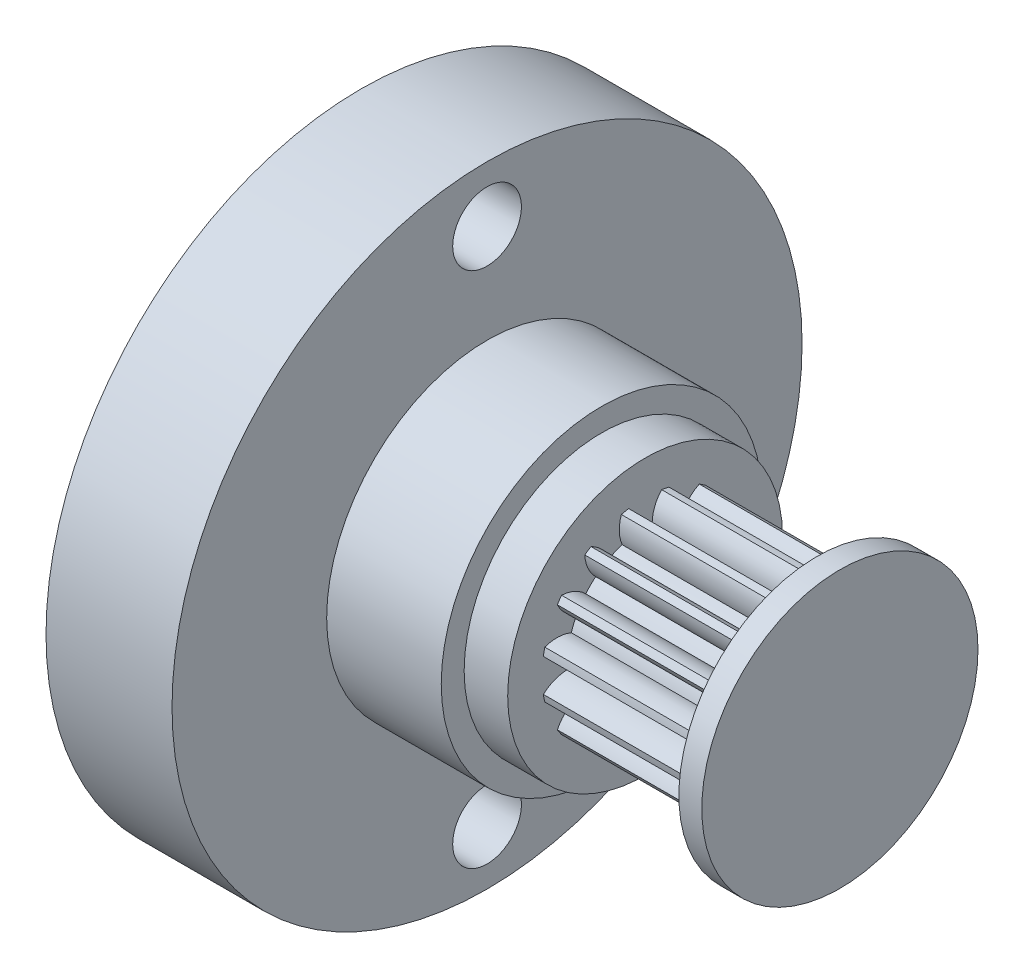
from build123d import *

# Parameters (mm, degrees)
BASPROSKE_W             = 7.5
BASPROSKE_H             = 4.5
TOOTHCUT_DEPTH          = 10.836157786
TEETHCUTS_COUNT         = 16
TEETHCUTS_ANGLE         = 337.5
BORSKE_R                = 2.5
BORE_DEPTH              = 50.0000508
ESQUISSE4_R             = 6
BOSS_EXTRU_3_DEPTH      = 1.9
ESQUISSE5_R             = 6.027848577
ESQUISSE5_R_2           = 2.85
BOSS_EXTRU_4_DEPTH      = 1
ESQUISSE7_R             = 3.00711341
BOSS_EXTRU_6_DEPTH      = 8.5
ESQUISSE8_R             = 7
ESQUISSE8_R_2           = 5.5
BOSS_EXTRU_7_DEPTH      = 7
BOSS_EXTRU_8_DEPTH      = 3.5
BOSS_EXTRU_8_DEPTH_BACK = 2
ESQUISSE9_R             = 13.75
ESQUISSE9_R_2           = 5.5
ESQUISSE10_R            = 1.5
ENL_V_MAT_EXTRU_3_DEPTH = 29.547066399
ESQUISSE11_R            = 3
ENL_V_MAT_EXTRU_4_DEPTH = 4
BOSS_EXTRU_9_START      = 2.1
ESQUISSE13_R            = 5.5
BOSS_EXTRU_9_DEPTH      = 10
ENL_V_START             = -4
ESQUISSE14_R            = 5.5
ENL_V_MAT_EXTRU_5_DEPTH = 4
ESQUISSE15_R            = 3.3
BOSS_EXTRU_10_DEPTH     = 14.5


with BuildPart() as part:
    # BasProSke → Base-Revolve (revolve)
    with BuildSketch(Plane(origin=(0, 0, 0), x_dir=(1, 0, 0), z_dir=(0, 1, 0)), mode=Mode.PRIVATE) as base_revolve_sk:
        with Locations((3.75, 2.25)):
            Rectangle(BASPROSKE_W, BASPROSKE_H)
    revolve(base_revolve_sk.sketch.rotate(Axis((-10, 0, 0), (1, 0, 0)), 180), axis=Axis((-10, 0, 0), (1, 0, 0)))

    # TooCutSke → ToothCut (cut, through all)
    with BuildSketch(Plane(origin=(0, 0, 0), x_dir=(0, 0, -1), z_dir=(1, 0, 0))):
        with BuildLine():
            ThreePointArc((0.306025637, 3.360092902), (0, 3.374), (-0.306025637, 3.360092902))
            ThreePointArc((-0.306025637, 3.360092902), (-0.415941512, 3.953968919), (-0.738171669, 4.464789776))
            ThreePointArc((-0.738171669, 4.464789776), (0, 4.5254), (0.738171669, 4.464789776))
            ThreePointArc((0.738171669, 4.464789776), (0.415941512, 3.953968919), (0.306025637, 3.360092902))
        make_face()
    toothcut = extrude(amount=TOOTHCUT_DEPTH, mode=Mode.SUBTRACT)

    # TeethCuts: ToothCut ×16 about axis
    teethcuts_axis = Axis((-10, 0, 0), (1, 0, 0))
    for i in range(1, TEETHCUTS_COUNT):
        add(toothcut.rotate(teethcuts_axis, i * TEETHCUTS_ANGLE / (TEETHCUTS_COUNT - 1)), mode=Mode.SUBTRACT)

    # BorSke → Bore (cut, symmetric)
    with BuildSketch(Plane(origin=(0, 0, 0), x_dir=(0, 0, -1), z_dir=(1, 0, 0))):
        with Locations(Location((0, 0, 0), (0, 0, 180))):
            Circle(BORSKE_R)
    extrude(amount=BORE_DEPTH, both=True, mode=Mode.SUBTRACT)

    # Esquisse4 → Boss.-Extru.3 (add)
    with BuildSketch(Plane.ZY):
        with Locations(Location((0, 0, 0), (0, 0, 180))):
            Circle(ESQUISSE4_R)
    extrude(amount=BOSS_EXTRU_3_DEPTH)

    # Esquisse5 → Boss.-Extru.4 (add)
    with BuildSketch(Plane(origin=(7.5, 0, 0), x_dir=(0, 0, -1), z_dir=(1, 0, 0))):
        Circle(ESQUISSE5_R)
        Circle(ESQUISSE5_R_2, mode=Mode.SUBTRACT)
    extrude(amount=BOSS_EXTRU_4_DEPTH)

    # Esquisse7 → Boss.-Extru.6 (add)
    with BuildSketch(Plane(origin=(0, 0, 0), x_dir=(0, 0, -1), z_dir=(1, 0, 0))):
        Circle(ESQUISSE7_R)
    extrude(amount=BOSS_EXTRU_6_DEPTH)

    # Esquisse8 → Boss.-Extru.7 (add)
    with BuildSketch(Plane.ZY.offset(1.9)):
        Circle(ESQUISSE8_R)
        Circle(ESQUISSE8_R_2, mode=Mode.SUBTRACT)
    extrude(amount=BOSS_EXTRU_7_DEPTH)

    # Esquisse9 → Boss.-Extru.8 (add, two sides: drawn at the far end of the back side and taken through both)
    with BuildSketch(Plane.ZY.offset(8.9).offset(-BOSS_EXTRU_8_DEPTH_BACK)):
        Circle(ESQUISSE9_R)
        Circle(ESQUISSE9_R_2, mode=Mode.SUBTRACT)
    extrude(amount=BOSS_EXTRU_8_DEPTH + BOSS_EXTRU_8_DEPTH_BACK)

    # Esquisse10 → Enlèv. mat.-Extru.3 (cut, through all)
    with BuildSketch(Plane.ZY.offset(12.4)):
        with Locations((0, 11.3)):
            Circle(ESQUISSE10_R)
        with Locations((0, -11.3)):
            Circle(ESQUISSE10_R)
    extrude(amount=-ENL_V_MAT_EXTRU_3_DEPTH, mode=Mode.SUBTRACT)

    # Esquisse11 → Enlèv. mat.-Extru.4 (cut)
    with BuildSketch(Plane.ZY.offset(1.9)):
        Circle(ESQUISSE11_R)
    extrude(amount=-ENL_V_MAT_EXTRU_4_DEPTH, mode=Mode.SUBTRACT)

    # Esquisse13 → Boss.-Extru.9 (add)
    with BuildSketch(Plane.ZY.offset(-2.1).offset(BOSS_EXTRU_9_START)):
        Circle(ESQUISSE13_R)
    extrude(amount=BOSS_EXTRU_9_DEPTH)

    # Esquisse14 → Enlèv. mat.-Extru.5 (cut)
    with BuildSketch(Plane.ZY.offset(10).offset(ENL_V_START)):
        Circle(ESQUISSE14_R)
    extrude(amount=ENL_V_MAT_EXTRU_5_DEPTH, mode=Mode.SUBTRACT)

    # Esquisse15 → Boss.-Extru.10 (add)
    with BuildSketch(Plane.ZY.offset(6)):
        Circle(ESQUISSE15_R)
    extrude(amount=-BOSS_EXTRU_10_DEPTH)


solid = part.part
